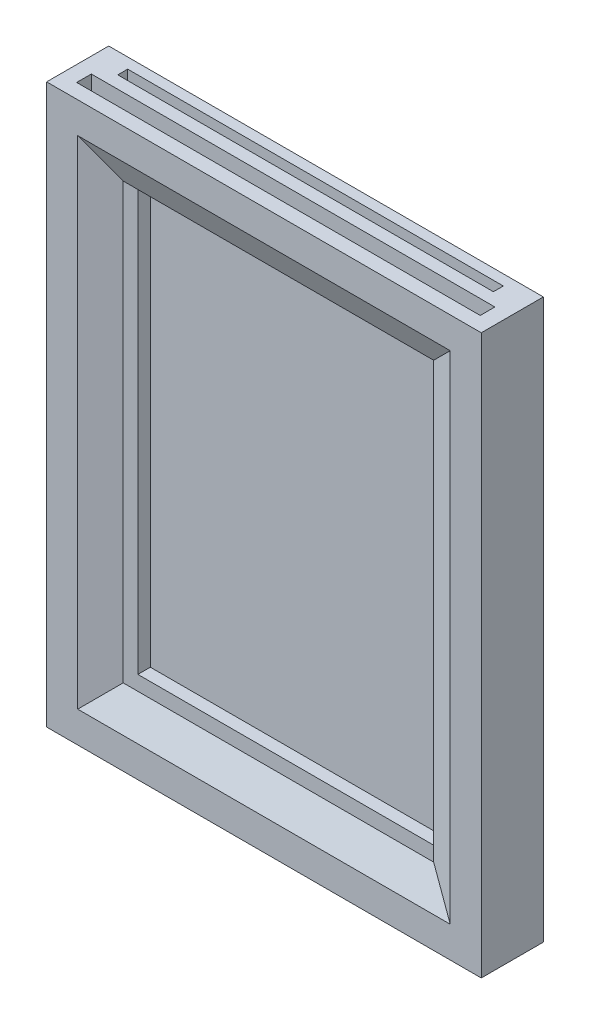
from build123d import *

# Parameters (mm, degrees)
SKETCH1_W            = 88.9
SKETCH1_H            = 114.3
BOSS_EXTRUDE1_DEPTH  = 12.7
SKETCH2_W            = 76.835
SKETCH2_H            = 2.032
TOPLOADER_CUT_DEPTH  = 105.41
SKETCH3_W            = 63.5
SKETCH3_H            = 88.9
VIEWING_WINDOW_DEPTH = 9.525
CHAMFER1_SIZE        = 6.35
CHAMFER1_SIZE2       = 2.961053629
ACRYLIC_CUT_W        = 82.55
ACRYLIC_CUT_H        = 3
CUT_EXTRUDE1_DEPTH   = 109.22


with BuildPart() as part:
    # Sketch1 → Boss-Extrude1 (new body)
    with BuildSketch(Plane.XY):
        with Locations((44.45, 57.15)):
            Rectangle(SKETCH1_W, SKETCH1_H)
    extrude(amount=BOSS_EXTRUDE1_DEPTH)

    # Sketch2 → toploader_cut (cut)
    with BuildSketch(Plane(origin=(0, 114.3, 0), x_dir=(1, 0, 0), z_dir=(0, 1, 0))):
        with Locations((44.45, -3.175)):
            Rectangle(SKETCH2_W, SKETCH2_H)
    extrude(amount=-TOPLOADER_CUT_DEPTH, mode=Mode.SUBTRACT)

    # Sketch3 → viewing_window (cut)
    with BuildSketch(Plane.XY.offset(12.7)):
        with Locations((44.45, 57.15)):
            Rectangle(SKETCH3_W, SKETCH3_H)
    extrude(amount=-VIEWING_WINDOW_DEPTH, mode=Mode.SUBTRACT)

    # Chamfer1
    chamfer1_edges = [part.edges().sort_by_distance(p)[0] for p in [
        (12.7, 57.15, 12.7),
        (44.45, 12.7, 12.7),
        (76.2, 57.15, 12.7),
        (44.45, 101.6, 12.7),
    ]]
    chamfer1_side = [part.faces().sort_by_distance(p)[0] for p in [
        (44.45, 1.44802279, 12.7),
    ]]
    chamfer(chamfer1_edges, length=CHAMFER1_SIZE, length2=CHAMFER1_SIZE2, reference=chamfer1_side[0])

    # acrylic_cut → Cut-Extrude1 (cut)
    with BuildSketch(Plane(origin=(0, 114.3, 0), x_dir=(1, 0, 0), z_dir=(0, 1, 0))):
        with Locations((44.45, -8.238946371)):
            Rectangle(ACRYLIC_CUT_W, ACRYLIC_CUT_H)
    extrude(amount=-CUT_EXTRUDE1_DEPTH, mode=Mode.SUBTRACT)


solid = part.part
